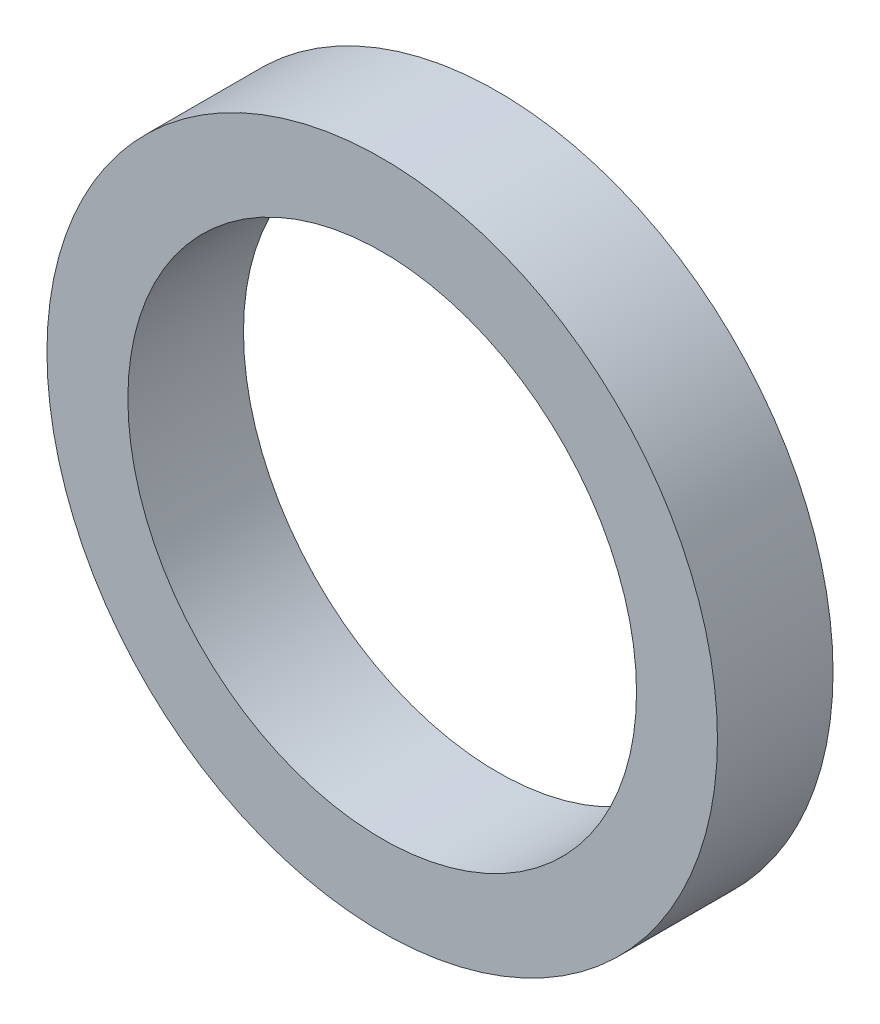
from build123d import *

# Parameters (mm, degrees)
SKETCH_1_R      = 72.5
SKETCH_1_R_2    = 55
EXTRUDE_1_DEPTH = 25


with BuildPart() as part:
    # 스케치1 → 보스-돌출1 (new body)
    with BuildSketch(Plane.XY):
        Circle(SKETCH_1_R)
        Circle(SKETCH_1_R_2, mode=Mode.SUBTRACT)
    extrude(amount=EXTRUDE_1_DEPTH)


solid = part.part
